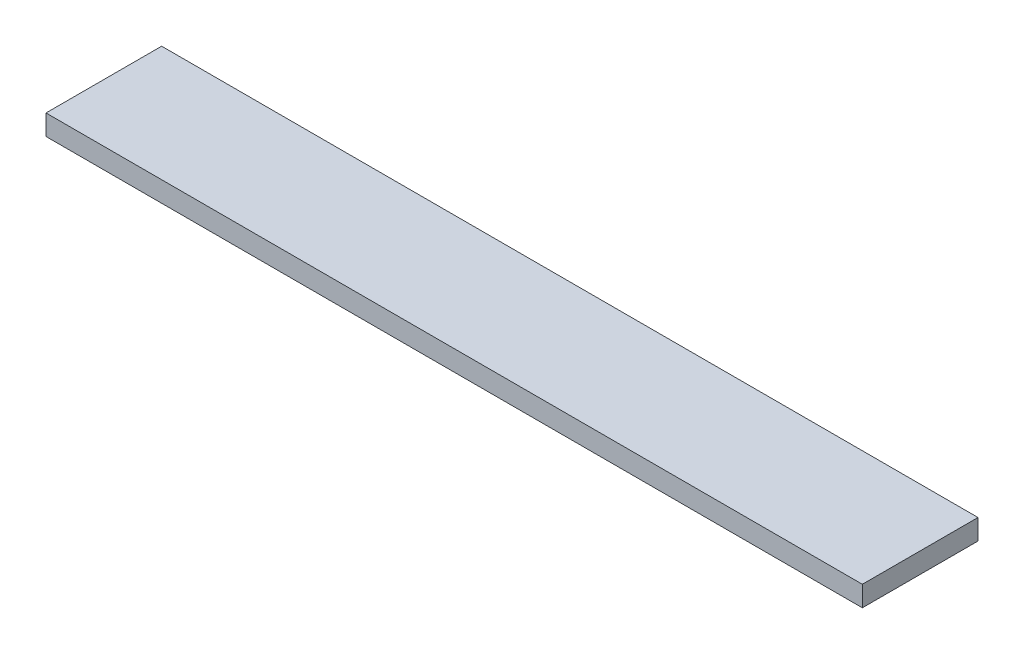
from build123d import *

# Parameters (mm, degrees)
CROQUIS1_W              = 120
CROQUIS1_H              = 17
SALIENTE_EXTRUIR1_DEPTH = 3


with BuildPart() as part:
    # Croquis1 → Saliente-Extruir1 (new body)
    with BuildSketch(Plane(origin=(0, 0, 0), x_dir=(1, 0, 0), z_dir=(0, 1, 0))):
        Rectangle(CROQUIS1_W, CROQUIS1_H)
    extrude(amount=SALIENTE_EXTRUIR1_DEPTH)


solid = part.part
